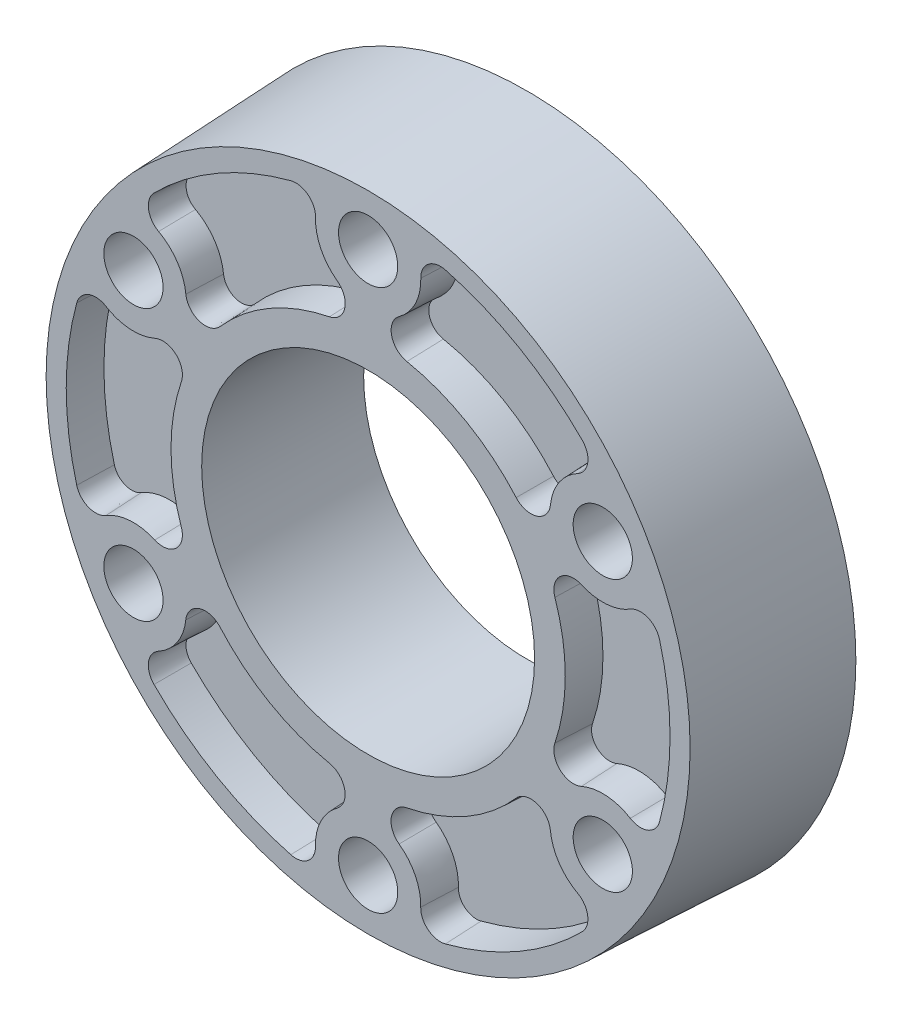
from build123d import *

# Parameters (mm, degrees)
CUT_EXTRUDE1_DEPTH = 3.175
CUT_EXTRUDE1_DRAFT = -2.499999997
CUT_EXTRUDE2_DEPTH = 3.175
CUT_EXTRUDE2_DRAFT = -2.499999997
CUT_EXTRUDE3_DEPTH = 3.175
CUT_EXTRUDE3_DRAFT = -2.499999997
CUT_EXTRUDE4_DEPTH = 3.175
CUT_EXTRUDE4_DRAFT = -2.499999997
CUT_EXTRUDE5_DEPTH = 3.175
CUT_EXTRUDE5_DRAFT = -2.499999997
CUT_EXTRUDE6_DEPTH = 3.175
CUT_EXTRUDE6_DRAFT = -2.499999997
HOLE1_AT_2_COUNT   = 2
HOLE1_AT_2_PITCH   = 23.8125
HOLE1_AT_3_COUNT   = 2
HOLE1_AT_3_PITCH   = 41.244459855
HOLE1_AT_4_COUNT   = 2
HOLE1_AT_4_PITCH   = 47.625
HOLE3_AT_2_COUNT   = 2
HOLE3_AT_2_PITCH   = 23.8125


with BuildPart() as part:
    # Sketch1 → Revolve1 (revolve)
    with BuildSketch(Plane(origin=(0, 0, 0), x_dir=(1, 0, 0), z_dir=(0, 1, 0))):
        Polygon((28.907115854, 10.781703656), (0, 10.781703656), (0, -3.175), (28.297753013, -3.175), align=None)
    revolve(axis=Axis((0, 0, -10.781703656), (0, 0, 1)))


with BuildPart() as cut_extrude1_tool:
    # Sketch2 → Cut-Extrude1 (with draft: the straight prism first)
    with BuildSketch(Plane.XY.offset(3.175)):
        with BuildLine():
            ThreePointArc((-18.412322915, 15.975071512), (-16.774840019, 14.48240768), (-16.018385207, 12.399819948))
            ThreePointArc((-16.018385207, 12.399819948), (-14.824369054, 10.938604706), (-13.006181472, 11.443598242))
            ThreePointArc((-13.006181472, 11.443598242), (-8.658542341, 15.004877265), (-3.399666872, 16.987023352))
            ThreePointArc((-3.399666872, 16.987023352), (-2.052383538, 18.309669286), (-2.722192076, 20.074866491))
            ThreePointArc((-2.722192076, 20.074866491), (-4.148376637, 21.770147136), (-4.622272981, 23.934263844))
            ThreePointArc((-4.622272981, 23.934263844), (-5.27701362, 25.333574104), (-6.789514671, 25.648367816))
            ThreePointArc((-6.789514671, 25.648367816), (-13.262833976, 22.978979873), (-18.812390624, 18.709095117))
            ThreePointArc((-18.812390624, 18.709095117), (-19.296416457, 17.241985352), (-18.412322915, 15.975071512))
        make_face()
    extrude(amount=-CUT_EXTRUDE1_DEPTH)
    # Cut-Extrude1: the draft: its side faces are tilted about the plane it starts from
    cut_extrude1_sides = [cut_extrude1_tool.faces().sort_by_distance(p)[0] for p in [
        (-19.296416457, 17.241985352, 1.5875),
        (-16.774840019, 14.48240768, 1.5875),
        (-14.824369054, 10.938604706, 1.5875),
        (-8.658542341, 15.004877265, 1.5875),
        (-2.052383538, 18.309669286, 1.5875),
        (-4.148376637, 21.770147136, 1.5875),
        (-5.27701362, 25.333574104, 1.5875),
        (-13.262833976, 22.978979873, 1.5875),
    ]]
    draft(cut_extrude1_sides, Plane.XY.offset(3.175), CUT_EXTRUDE1_DRAFT)


with BuildPart() as part_1:
    add(part.part)

    # Cut-Extrude1: cut by cut_extrude1_tool
    add(cut_extrude1_tool.part, mode=Mode.SUBTRACT)


with BuildPart() as cut_extrude2_tool:
    # Sketch3 → Cut-Extrude2 (with draft: the straight prism first)
    with BuildSketch(Plane.XY.offset(3.175)):
        with BuildLine():
            ThreePointArc((4.628656299, 23.933075143), (4.15471295, 21.768641441), (2.729366473, 20.072238491))
            ThreePointArc((2.729366473, 20.072238491), (2.06092503, 18.307582549), (3.407356052, 16.985482682))
            ThreePointArc((3.407356052, 16.985482682), (8.665333722, 15.000956259), (13.011360321, 11.437709552))
            ThreePointArc((13.011360321, 11.437709552), (14.830446967, 10.932250925), (16.024248321, 12.394920737))
            ThreePointArc((16.024248321, 12.394920737), (16.779312145, 14.47767312), (18.416544019, 15.970137747))
            ThreePointArc((18.416544019, 15.970137747), (19.301011933, 17.236814903), (18.817380759, 18.704076092))
            ThreePointArc((18.817380759, 18.704076092), (13.268963335, 22.975441086), (6.796356341, 25.646555745))
            ThreePointArc((6.796356341, 25.646555745), (5.283789098, 25.33217953), (4.628656299, 23.933075143))
        make_face()
    extrude(amount=-CUT_EXTRUDE2_DEPTH)
    # Cut-Extrude2: the draft: its side faces are tilted about the plane it starts from
    cut_extrude2_sides = [cut_extrude2_tool.faces().sort_by_distance(p)[0] for p in [
        (5.283789098, 25.33217953, 1.5875),
        (4.15471295, 21.768641441, 1.5875),
        (2.06092503, 18.307582549, 1.5875),
        (8.665333722, 15.000956259, 1.5875),
        (14.830446967, 10.932250925, 1.5875),
        (16.779312145, 14.47767312, 1.5875),
        (19.301011933, 17.236814903, 1.5875),
        (13.268963335, 22.975441086, 1.5875),
    ]]
    draft(cut_extrude2_sides, Plane.XY.offset(3.175), CUT_EXTRUDE2_DRAFT)


with BuildPart() as part_2:
    add(part_1.part)

    # Cut-Extrude2: cut by cut_extrude2_tool
    add(cut_extrude2_tool.part, mode=Mode.SUBTRACT)


with BuildPart() as cut_extrude3_tool:
    # Sketch4 → Cut-Extrude3 (with draft: the straight prism first)
    with BuildSketch(Plane.XY.offset(3.175)):
        with BuildLine():
            ThreePointArc((23.040979214, 7.958003631), (20.929552969, 7.286233761), (18.747751681, 7.672418543))
            ThreePointArc((18.747751681, 7.672418543), (16.885294085, 7.368977843), (16.413537524, 5.54188444))
            ThreePointArc((16.413537524, 5.54188444), (17.323876063, -0.003921006), (16.411027194, -5.5493138))
            ThreePointArc((16.411027194, -5.5493138), (16.882830505, -7.377418361), (18.746440396, -7.679945754))
            ThreePointArc((18.746440396, -7.679945754), (20.927688782, -7.292474016), (23.038817, -7.964126097))
            ThreePointArc((23.038817, -7.964126097), (24.578025553, -8.096759201), (25.60689543, -6.944291723))
            ThreePointArc((25.60689543, -6.944291723), (26.531797311, -0.003538787), (25.608746965, 6.937460628))
            ThreePointArc((25.608746965, 6.937460628), (24.580205555, 8.090194178), (23.040979214, 7.958003631))
        make_face()
    extrude(amount=-CUT_EXTRUDE3_DEPTH)
    # Cut-Extrude3: the draft: its side faces are tilted about the plane it starts from
    cut_extrude3_sides = [cut_extrude3_tool.faces().sort_by_distance(p)[0] for p in [
        (26.531797311, -0.003538787, 1.5875),
        (24.580205555, 8.090194178, 1.5875),
        (20.929552969, 7.286233761, 1.5875),
        (16.885294085, 7.368977843, 1.5875),
        (17.323876063, -0.003921006, 1.5875),
        (16.882830505, -7.377418361, 1.5875),
        (20.927688782, -7.292474016, 1.5875),
        (24.578025553, -8.096759201, 1.5875),
    ]]
    draft(cut_extrude3_sides, Plane.XY.offset(3.175), CUT_EXTRUDE3_DRAFT)


with BuildPart() as part_3:
    add(part_2.part)

    # Cut-Extrude3: cut by cut_extrude3_tool
    add(cut_extrude3_tool.part, mode=Mode.SUBTRACT)


with BuildPart() as cut_extrude4_tool:
    # Sketch5 → Cut-Extrude4 (with draft: the straight prism first)
    with BuildSketch(Plane.XY.offset(3.175)):
        with BuildLine():
            ThreePointArc((18.412322915, -15.975071512), (16.774840019, -14.48240768), (16.018385207, -12.399819948))
            ThreePointArc((16.018385207, -12.399819948), (14.824369054, -10.938604706), (13.006181472, -11.443598242))
            ThreePointArc((13.006181472, -11.443598242), (8.658542341, -15.004877265), (3.399666872, -16.987023352))
            ThreePointArc((3.399666872, -16.987023352), (2.052383538, -18.309669286), (2.722192076, -20.074866491))
            ThreePointArc((2.722192076, -20.074866491), (4.148376637, -21.770147136), (4.622272981, -23.934263844))
            ThreePointArc((4.622272981, -23.934263844), (5.27701362, -25.333574104), (6.789514671, -25.648367816))
            ThreePointArc((6.789514671, -25.648367816), (13.262833976, -22.978979873), (18.812390624, -18.709095117))
            ThreePointArc((18.812390624, -18.709095117), (19.296416457, -17.241985352), (18.412322915, -15.975071512))
        make_face()
    extrude(amount=-CUT_EXTRUDE4_DEPTH)
    # Cut-Extrude4: the draft: its side faces are tilted about the plane it starts from
    cut_extrude4_sides = [cut_extrude4_tool.faces().sort_by_distance(p)[0] for p in [
        (19.296416457, -17.241985352, 1.5875),
        (16.774840019, -14.48240768, 1.5875),
        (14.824369054, -10.938604706, 1.5875),
        (8.658542341, -15.004877265, 1.5875),
        (2.052383538, -18.309669286, 1.5875),
        (4.148376637, -21.770147136, 1.5875),
        (5.27701362, -25.333574104, 1.5875),
        (13.262833976, -22.978979873, 1.5875),
    ]]
    draft(cut_extrude4_sides, Plane.XY.offset(3.175), CUT_EXTRUDE4_DRAFT)


with BuildPart() as part_4:
    add(part_3.part)

    # Cut-Extrude4: cut by cut_extrude4_tool
    add(cut_extrude4_tool.part, mode=Mode.SUBTRACT)


with BuildPart() as cut_extrude5_tool:
    # Sketch6 → Cut-Extrude5 (with draft: the straight prism first)
    with BuildSketch(Plane.XY.offset(3.175)):
        with BuildLine():
            ThreePointArc((-4.628656299, -23.933075143), (-4.15471295, -21.768641441), (-2.729366473, -20.072238491))
            ThreePointArc((-2.729366473, -20.072238491), (-2.06092503, -18.307582549), (-3.407356052, -16.985482682))
            ThreePointArc((-3.407356052, -16.985482682), (-8.665333722, -15.000956259), (-13.011360321, -11.437709552))
            ThreePointArc((-13.011360321, -11.437709552), (-14.830446967, -10.932250925), (-16.024248321, -12.394920737))
            ThreePointArc((-16.024248321, -12.394920737), (-16.779312145, -14.47767312), (-18.416544019, -15.970137747))
            ThreePointArc((-18.416544019, -15.970137747), (-19.301011933, -17.236814903), (-18.817380759, -18.704076092))
            ThreePointArc((-18.817380759, -18.704076092), (-13.268963335, -22.975441086), (-6.796356341, -25.646555745))
            ThreePointArc((-6.796356341, -25.646555745), (-5.283789098, -25.33217953), (-4.628656299, -23.933075143))
        make_face()
    extrude(amount=-CUT_EXTRUDE5_DEPTH)
    # Cut-Extrude5: the draft: its side faces are tilted about the plane it starts from
    cut_extrude5_sides = [cut_extrude5_tool.faces().sort_by_distance(p)[0] for p in [
        (-5.283789098, -25.33217953, 1.5875),
        (-4.15471295, -21.768641441, 1.5875),
        (-2.06092503, -18.307582549, 1.5875),
        (-8.665333722, -15.000956259, 1.5875),
        (-14.830446967, -10.932250925, 1.5875),
        (-16.779312145, -14.47767312, 1.5875),
        (-19.301011933, -17.236814903, 1.5875),
        (-13.268963335, -22.975441086, 1.5875),
    ]]
    draft(cut_extrude5_sides, Plane.XY.offset(3.175), CUT_EXTRUDE5_DRAFT)


with BuildPart() as part_5:
    add(part_4.part)

    # Cut-Extrude5: cut by cut_extrude5_tool
    add(cut_extrude5_tool.part, mode=Mode.SUBTRACT)


with BuildPart() as cut_extrude6_tool:
    # Sketch7 → Cut-Extrude6 (with draft: the straight prism first)
    with BuildSketch(Plane.XY.offset(3.175)):
        with BuildLine():
            ThreePointArc((-23.040979214, -7.958003631), (-20.929552969, -7.286233761), (-18.747751681, -7.672418543))
            ThreePointArc((-18.747751681, -7.672418543), (-16.885294085, -7.368977843), (-16.413537524, -5.54188444))
            ThreePointArc((-16.413537524, -5.54188444), (-17.323876063, 0.003921006), (-16.411027194, 5.5493138))
            ThreePointArc((-16.411027194, 5.5493138), (-16.882830505, 7.377418361), (-18.746440396, 7.679945754))
            ThreePointArc((-18.746440396, 7.679945754), (-20.927688782, 7.292474016), (-23.038817, 7.964126097))
            ThreePointArc((-23.038817, 7.964126097), (-24.578025553, 8.096759201), (-25.60689543, 6.944291723))
            ThreePointArc((-25.60689543, 6.944291723), (-26.531797311, 0.003538787), (-25.608746965, -6.937460628))
            ThreePointArc((-25.608746965, -6.937460628), (-24.580205555, -8.090194178), (-23.040979214, -7.958003631))
        make_face()
    extrude(amount=-CUT_EXTRUDE6_DEPTH)
    # Cut-Extrude6: the draft: its side faces are tilted about the plane it starts from
    cut_extrude6_sides = [cut_extrude6_tool.faces().sort_by_distance(p)[0] for p in [
        (-24.580205555, -8.090194178, 1.5875),
        (-20.929552969, -7.286233761, 1.5875),
        (-16.885294085, -7.368977843, 1.5875),
        (-17.323876063, 0.003921006, 1.5875),
        (-16.882830505, 7.377418361, 1.5875),
        (-20.927688782, 7.292474016, 1.5875),
        (-24.578025553, 8.096759201, 1.5875),
        (-26.531797311, 0.003538787, 1.5875),
    ]]
    draft(cut_extrude6_sides, Plane.XY.offset(3.175), CUT_EXTRUDE6_DRAFT)


with BuildPart() as part_6:
    add(part_5.part)

    # Cut-Extrude6: cut by cut_extrude6_tool
    add(cut_extrude6_tool.part, mode=Mode.SUBTRACT)

    # Sketch8 → Hole1 (revolve, cut)
    with BuildSketch(Plane(origin=(20.622229928, 11.90625, 3.175), x_dir=(0, -1, 0), z_dir=(1, 0, 0))):
        Polygon((0, 0), (0, 13.956703656), (2.326253013, 13.956703656), (2.6035, 0), align=None)
    hole1 = revolve(axis=Axis((20.622229928, 11.90625, -106.825), (0, 0, 1)), mode=Mode.SUBTRACT)

    # Hole1 at 2: Hole1 ×2
    with Locations(*[(0, -i * HOLE1_AT_2_PITCH, 0) for i in range(1, HOLE1_AT_2_COUNT)]):
        add(hole1, mode=Mode.SUBTRACT)

    # Hole1 at 3: Hole1 ×2
    with Locations(*[Vector(-0.500000000000001, -0.866025403784438, 0) * (i * HOLE1_AT_3_PITCH) for i in range(1, HOLE1_AT_3_COUNT)]):
        add(hole1, mode=Mode.SUBTRACT)

    # Hole1 at 4: Hole1 ×2
    with Locations(*[Vector(-0.8660254037844387, -0.49999999999999994, 0) * (i * HOLE1_AT_4_PITCH) for i in range(1, HOLE1_AT_4_COUNT)]):
        add(hole1, mode=Mode.SUBTRACT)

    # Sketch10 → Hole2 (revolve, cut)
    with BuildSketch(Plane(origin=(0, 0, 3.175), x_dir=(0, -1, 0), z_dir=(1, 0, 0))):
        Polygon((0, 0), (0, 13.956703656), (14.351, 13.956703656), (14.628246987, 0), align=None)
    revolve(axis=Axis((0, 0, -106.825), (0, 0, 1)), mode=Mode.SUBTRACT)

    # Sketch12 → Hole3 (revolve, cut)
    with BuildSketch(Plane(origin=(-20.622229928, 11.90625, 3.175), x_dir=(0, -1, 0), z_dir=(1, 0, 0))):
        Polygon((0, 0), (0, 13.956703656), (2.381753114, 13.956703656), (2.6035, 0), align=None)
    hole3 = revolve(axis=Axis((-20.622229928, 11.90625, -106.825), (0, 0, 1)), mode=Mode.SUBTRACT)

    # Hole3 at 2: Hole3 ×2
    with Locations(*[Vector(0.8660254037844383, 0.5000000000000009, 0) * (i * HOLE3_AT_2_PITCH) for i in range(1, HOLE3_AT_2_COUNT)]):
        add(hole3, mode=Mode.SUBTRACT)


solid = part_6.part
